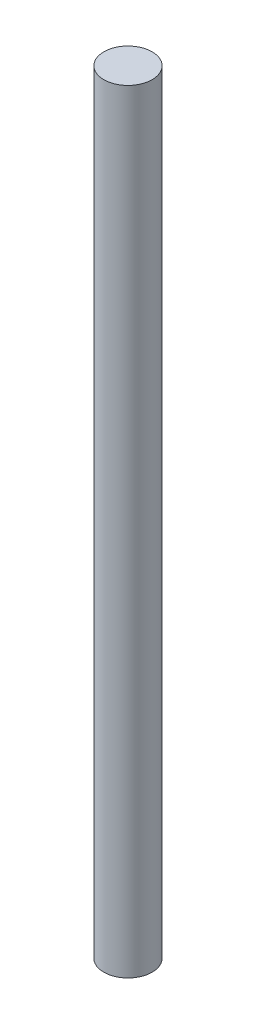
from build123d import *

# Parameters (mm, degrees)
SKETCH2_R           = 3.175
BOSS_EXTRUDE1_DEPTH = 50.8


with BuildPart() as part:
    # Sketch2 → Boss-Extrude1 (new, symmetric)
    with BuildSketch(Plane(origin=(0, 0, 0), x_dir=(1, 0, 0), z_dir=(0, 1, 0))):
        with Locations(Location((0, 0, 0), (0, 0, 270))):
            Circle(SKETCH2_R)
    extrude(amount=BOSS_EXTRUDE1_DEPTH, both=True)


solid = part.part
